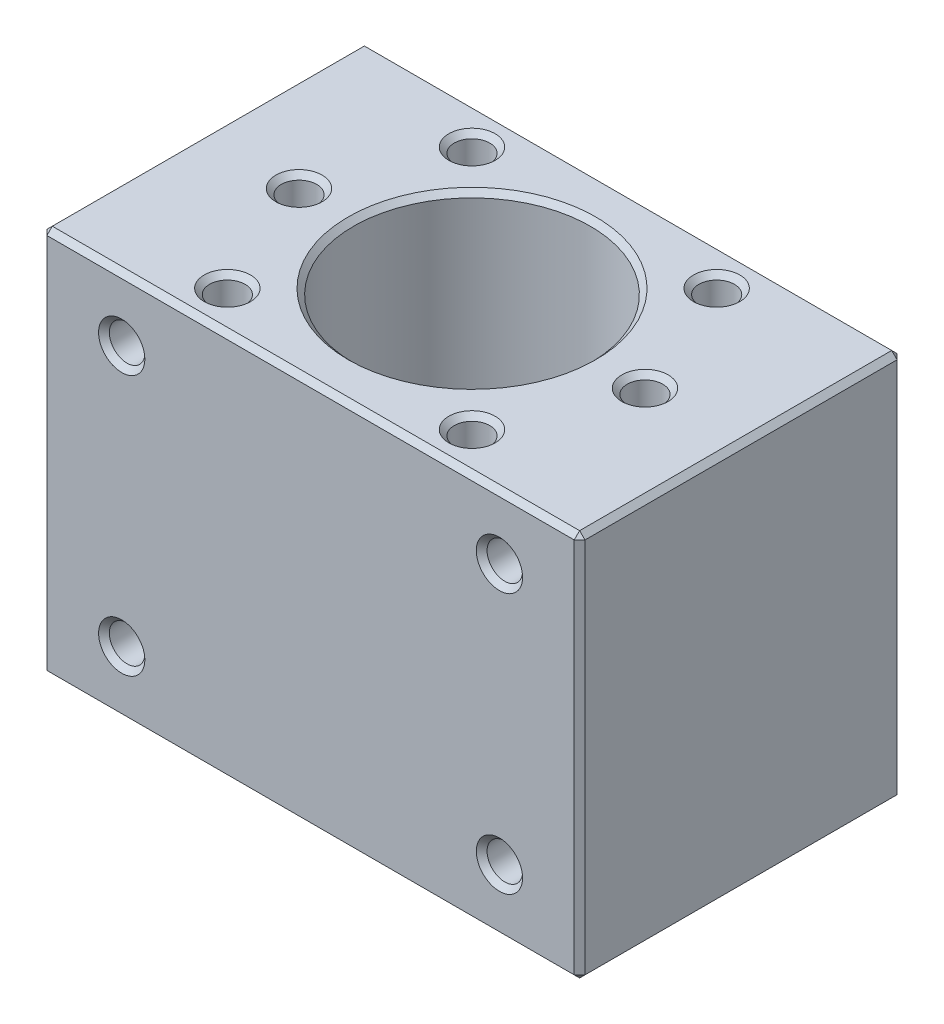
from build123d import *

# Parameters (mm, degrees)
SKETCH1_W                       = 50
SKETCH1_H                       = 30
SKETCH1_R                       = 1.65
SKETCH1_R_2                     = 11
BOSS_EXTRUDE1_DEPTH             = 36
TAP_DRILL_FOR_M4X0_7_TAP1_D     = 3.3
TAP_DRILL_FOR_M4X0_7_TAP1_DEPTH = 10
TAP_DRILL_FOR_M4X0_7_TAP1_TIP   = 0.991420021
TAP_DRILL_FOR_M4X0_7_TAP2_D     = 3.3
TAP_DRILL_FOR_M4X0_7_TAP2_DEPTH = 13
TAP_DRILL_FOR_M4X0_7_TAP2_TIP   = 0.991420021
CHAMFER1_SIZE                   = 0.5


with BuildPart() as part:
    # Sketch1 → Boss-Extrude1 (new body)
    # profile 1 of 7: a face of its own
    with BuildSketch(Plane(origin=(0, 0, 0), x_dir=(1, 0, 0), z_dir=(0, 1, 0))):
        with Locations((25, 15)):
            Rectangle(SKETCH1_W, SKETCH1_H)
        with Locations((36.366741508, 3.633258492)):
            Circle(SKETCH1_R, mode=Mode.SUBTRACT)
        with Locations((13.633258492, 3.633258492)):
            Circle(SKETCH1_R, mode=Mode.SUBTRACT)
        with Locations((8.925, 15)):
            Circle(SKETCH1_R, mode=Mode.SUBTRACT)
        with Locations((13.633258492, 26.366741508)):
            Circle(SKETCH1_R, mode=Mode.SUBTRACT)
        with Locations((36.366741508, 26.366741508)):
            Circle(SKETCH1_R, mode=Mode.SUBTRACT)
        with Locations((41.075, 15)):
            Circle(SKETCH1_R, mode=Mode.SUBTRACT)
        with Locations(Location((25, 15, 0), (0, 0, 270))):
            Circle(SKETCH1_R_2, mode=Mode.SUBTRACT)
    # profile 2 of 7: a face of its own
    with BuildSketch(Plane(origin=(0, 0, 0), x_dir=(1, 0, 0), z_dir=(0, 1, 0))):
        with Locations((41.075, 15)):
            Circle(SKETCH1_R)
    # profile 3 of 7: a face of its own
    with BuildSketch(Plane(origin=(0, 0, 0), x_dir=(1, 0, 0), z_dir=(0, 1, 0))):
        with Locations((36.366741508, 26.366741508)):
            Circle(SKETCH1_R)
    # profile 4 of 7: a face of its own
    with BuildSketch(Plane(origin=(0, 0, 0), x_dir=(1, 0, 0), z_dir=(0, 1, 0))):
        with Locations((36.366741508, 3.633258492)):
            Circle(SKETCH1_R)
    # profile 5 of 7: a face of its own
    with BuildSketch(Plane(origin=(0, 0, 0), x_dir=(1, 0, 0), z_dir=(0, 1, 0))):
        with Locations((13.633258492, 3.633258492)):
            Circle(SKETCH1_R)
    # profile 6 of 7: a face of its own
    with BuildSketch(Plane(origin=(0, 0, 0), x_dir=(1, 0, 0), z_dir=(0, 1, 0))):
        with Locations((8.925, 15)):
            Circle(SKETCH1_R)
    # profile 7 of 7: a face of its own
    with BuildSketch(Plane(origin=(0, 0, 0), x_dir=(1, 0, 0), z_dir=(0, 1, 0))):
        with Locations((13.633258492, 26.366741508)):
            Circle(SKETCH1_R)
    extrude(amount=-BOSS_EXTRUDE1_DEPTH)

    # Tap Drill for M4x0.7 Tap1
    with Locations(Plane(origin=(8.925, 0, -15), x_dir=(0, 0, 1), z_dir=(0, 1, 0))):
        with Locations((0, 0), (-11.366741508, 4.708258492), (-11.366741508, 27.441741508), (0, 32.15), (11.366741508, 27.441741508), (11.366741508, 4.708258492)):
            Hole(TAP_DRILL_FOR_M4X0_7_TAP1_D / 2, depth=TAP_DRILL_FOR_M4X0_7_TAP1_DEPTH)
            with Locations((0, 0, -(TAP_DRILL_FOR_M4X0_7_TAP1_DEPTH + TAP_DRILL_FOR_M4X0_7_TAP1_TIP / 2))):  # 118° drill point
                Cone(0, TAP_DRILL_FOR_M4X0_7_TAP1_D / 2, TAP_DRILL_FOR_M4X0_7_TAP1_TIP, mode=Mode.SUBTRACT)

    # Tap Drill for M4x0.7 Tap2
    with Locations(Plane(origin=(7.45, -5.9, 0), x_dir=(1, 0, 0), z_dir=(0, 0, 1))):
        with Locations((0, 0), (35.1, 0), (35.1, -24.2), (0, -24.2)):
            Hole(TAP_DRILL_FOR_M4X0_7_TAP2_D / 2, depth=TAP_DRILL_FOR_M4X0_7_TAP2_DEPTH)
            with Locations((0, 0, -(TAP_DRILL_FOR_M4X0_7_TAP2_DEPTH + TAP_DRILL_FOR_M4X0_7_TAP2_TIP / 2))):  # 118° drill point
                Cone(0, TAP_DRILL_FOR_M4X0_7_TAP2_D / 2, TAP_DRILL_FOR_M4X0_7_TAP2_TIP, mode=Mode.SUBTRACT)

    # Chamfer1
    chamfer1_edges = [part.edges().sort_by_distance(p)[0] for p in [
        (0, -18, 0),
        (0, -18, -30),
        (50, -18, -30),
        (25, -36, 0),
        (50, -18, 0),
        (50, -36, -15),
        (13.633258492, 0, -1.983258492),
        (25, -36, -30),
        (36.366741508, 0, -1.983258492),
        (0, -36, -15),
        (41.075, 0, -13.35),
        (36.366741508, 0, -24.716741508),
        (13.633258492, 0, -24.716741508),
        (8.925, 0, -13.35),
        (9.1, -30.1, 0),
        (44.2, -30.1, 0),
        (44.2, -5.9, 0),
        (25, -36, -26),
        (9.1, -5.9, 0),
        (0, 0, -15),
        (25, 0, -30),
        (50, 0, -15),
        (25, 0, 0),
        (25, 0, -26),
    ]]
    chamfer(chamfer1_edges, length=CHAMFER1_SIZE)


solid = part.part
